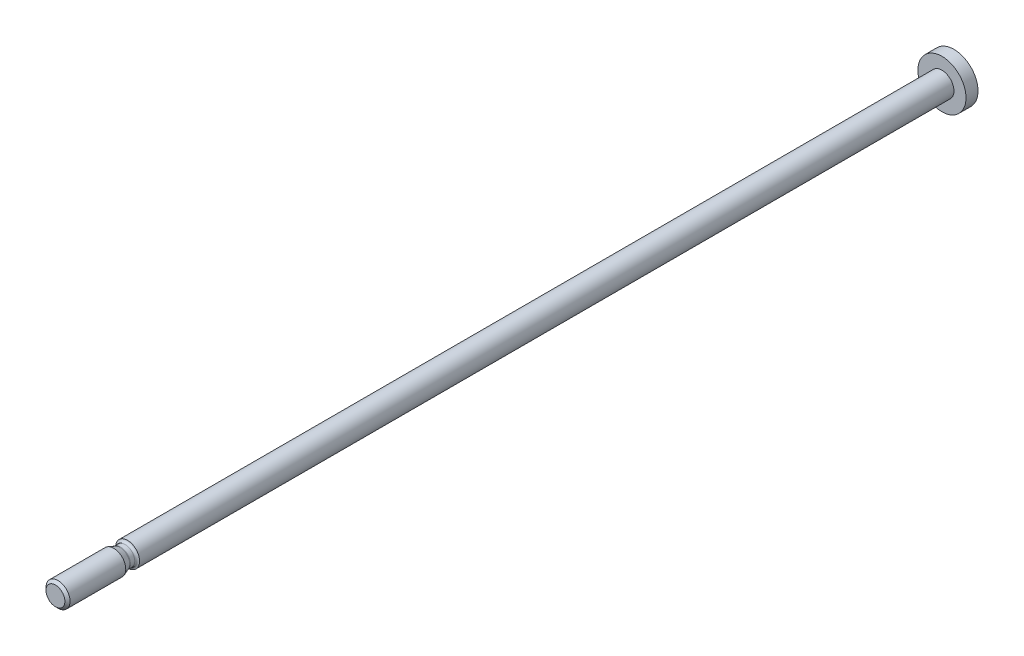
from build123d import *


with BuildPart() as part:
    # Skizze1 → Rotation1 (revolve)
    with BuildSketch(Plane(origin=(0, 0, 0), x_dir=(0, 0, -1), z_dir=(1, 0, 0))):
        Polygon((-4, 0), (-4, 2), (131.5, 2), (131.5, 4), (133.5, 4), (133.5, 0), align=None)
    revolve(axis=Axis((0, 0, -133.5), (0, 0, 1)))

    # Skizze2 → Rotation2 (revolve)
    with BuildSketch(Plane(origin=(0, 0, 0), x_dir=(0, 0, -1), z_dir=(1, 0, 0))):
        with BuildLine():
            Line((-16, 0), (-16, 1.5705))
            Line((-16, 1.5705), (-15.5705, 2))
            Line((-15.5705, 2), (-6.298990968, 2))
            Line((-6.298990968, 2), (-5.266277265, 1.624122952))
            ThreePointArc((-5.266277265, 1.624122952), (-5.198928479, 1.606076899), (-5.129469208, 1.6))
            Line((-5.129469208, 1.6), (-4.4, 1.6))
            ThreePointArc((-4.4, 1.6), (-4.117157288, 1.717157288), (-4, 2))
            Line((-4, 2), (-3, 2))
            Line((-3, 2), (-3, 0))
            Line((-3, 0), (-16, 0))
        make_face()
    revolve(axis=Axis((0, 0, 3), (0, 0, 1)))


solid = part.part
